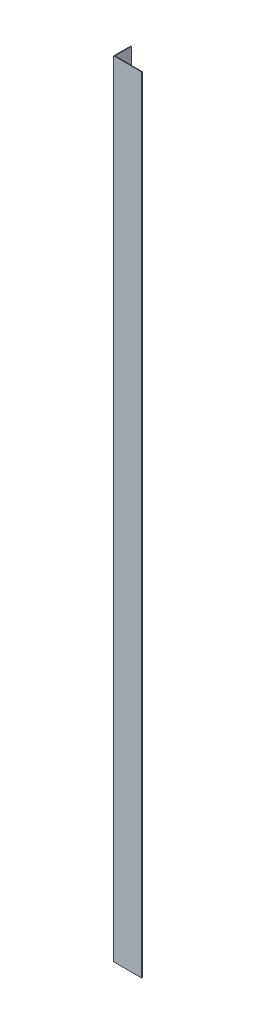
from build123d import *

# Parameters (mm, degrees)
STORE_SOVE_SAG_1_START = 120
STORE_SOVE_SAG_1_DEPTH = 1850


with BuildPart() as part:
    # Sketch1 → STORE_sove_sag_1 (new body)
    with BuildSketch(Plane(origin=(0, 0, 0), x_dir=(1, 0, 0), z_dir=(0, 1, 0)).offset(STORE_SOVE_SAG_1_START)):
        Polygon((1400, -40), (1400, -38.5), (1335.5, -38.5), (1335.5, 0), (1334, 0), (1334, -40), align=None)
    extrude(amount=STORE_SOVE_SAG_1_DEPTH)


solid = part.part
